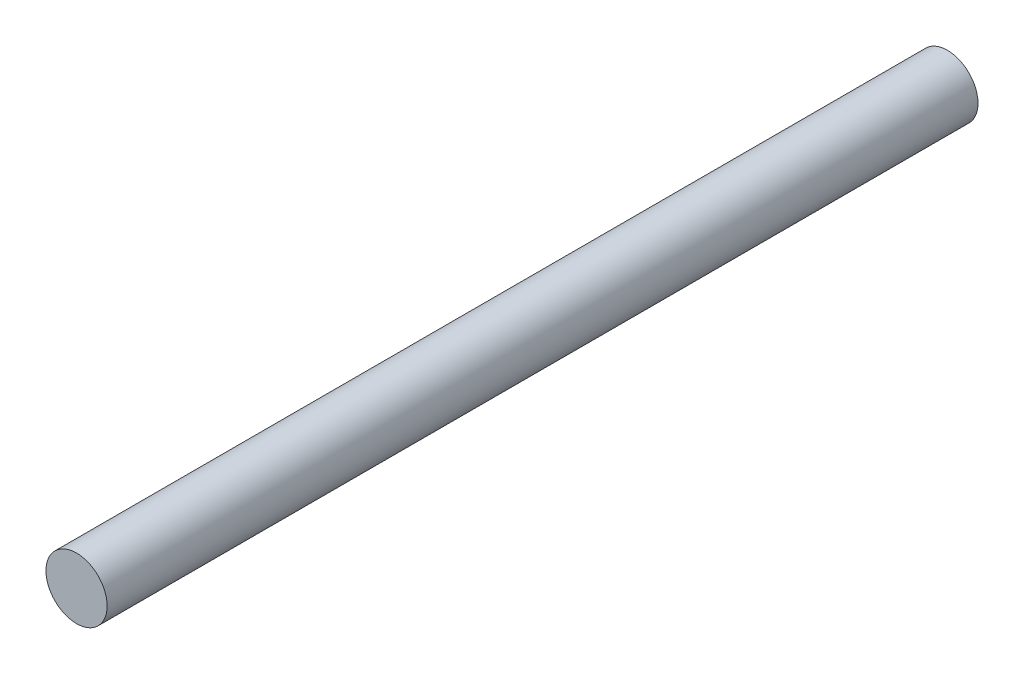
from build123d import *

# Parameters (mm, degrees)
SKETCH_1_R           = 2
CABLE_ENVELOPE_DEPTH = 56.92


with BuildPart() as part:
    # 草图1 → Cable_envelope (new body)
    with BuildSketch(Plane.XY):
        Circle(SKETCH_1_R)
    extrude(amount=CABLE_ENVELOPE_DEPTH)


solid = part.part
